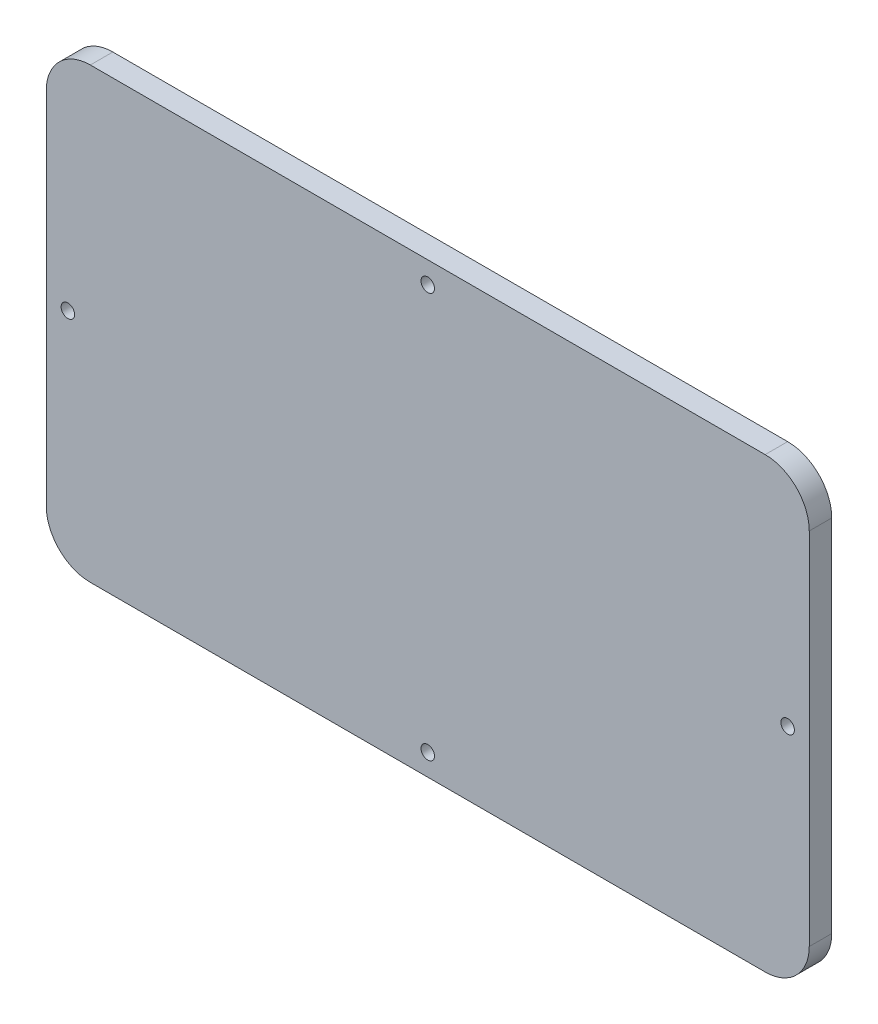
from build123d import *

# Parameters (mm, degrees)
ESBO_O1_R                = 1.5
RESSALTO_EXTRUS_O1_DEPTH = 5


with BuildPart() as part:
    # Esboço1 → Ressalto-extrusão1 (new body)
    with BuildSketch(Plane.XY):
        with BuildLine():
            Line((84.8, -40), (84.8, 40))
            ThreePointArc((84.8, 40), (81.929646456, 46.929646456), (75, 49.8))
            Line((75, 49.8), (-75, 49.8))
            ThreePointArc((-75, 49.8), (-81.929646456, 46.929646456), (-84.8, 40))
            Line((-84.8, 40), (-84.8, -40))
            ThreePointArc((-84.8, -40), (-81.929646456, -46.929646456), (-75, -49.8))
            Line((-75, -49.8), (75, -49.8))
            ThreePointArc((75, -49.8), (81.929646456, -46.929646456), (84.8, -40))
        make_face()
        with Locations((0, -45)):
            Circle(ESBO_O1_R, mode=Mode.SUBTRACT)
        with Locations((80, 0)):
            Circle(ESBO_O1_R, mode=Mode.SUBTRACT)
        with Locations((0, 45)):
            Circle(ESBO_O1_R, mode=Mode.SUBTRACT)
        with Locations((-80, 0)):
            Circle(ESBO_O1_R, mode=Mode.SUBTRACT)
    extrude(amount=RESSALTO_EXTRUS_O1_DEPTH)


solid = part.part
